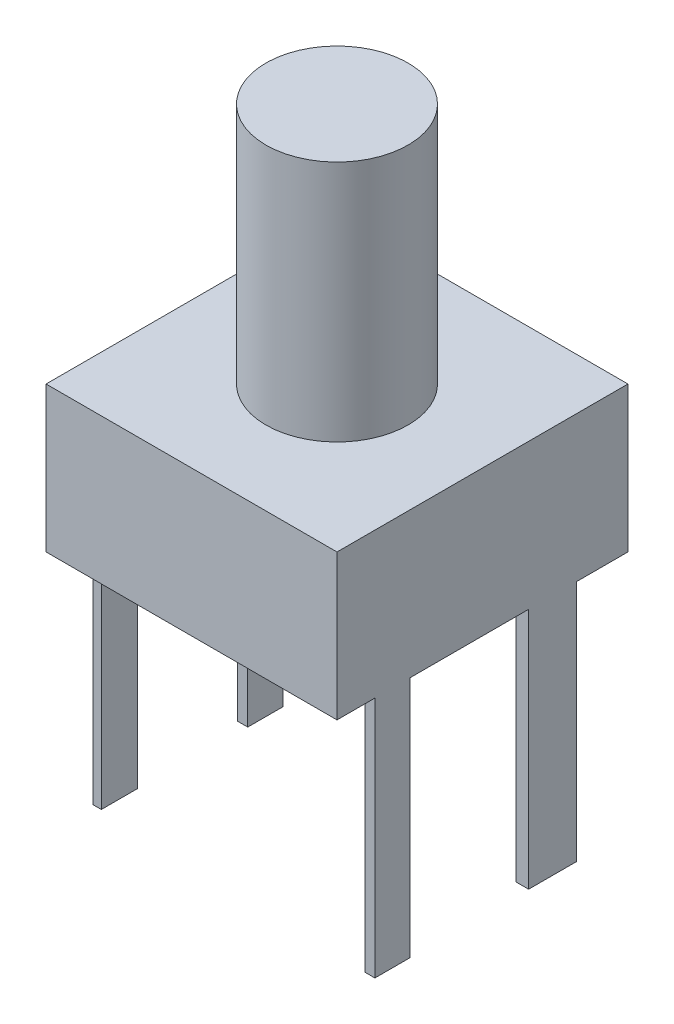
from build123d import *

# Parameters (mm, degrees)
SKETCH1_W           = 6
SKETCH1_H           = 6
BOSS_EXTRUDE1_DEPTH = 3
SKETCH2_R           = 1.46607231
BOSS_EXTRUDE2_DEPTH = 5
SKETCH3_W           = 0.169867938
SKETCH3_H           = 0.743920428
SKETCH3_W_2         = 0.207603032
SKETCH3_H_2         = 0.722357517
SKETCH3_W_3         = 0.261510309
SKETCH3_H_3         = 0.986503176
BOSS_EXTRUDE3_DEPTH = 5


with BuildPart() as part:
    # Sketch1 → Boss-Extrude1 (new body)
    with BuildSketch(Plane(origin=(0, 0, 0), x_dir=(1, 0, 0), z_dir=(0, 1, 0))):
        with Locations((3, -3)):
            Rectangle(SKETCH1_W, SKETCH1_H)
    extrude(amount=BOSS_EXTRUDE1_DEPTH)

    # Sketch2 → Boss-Extrude2 (add)
    with BuildSketch(Plane(origin=(0, 3, 0), x_dir=(1, 0, 0), z_dir=(0, 1, 0))):
        with Locations(Location((3, -3, 0), (0, 0, 270))):
            Circle(SKETCH2_R)
    extrude(amount=BOSS_EXTRUDE2_DEPTH)

    # Sketch3 → Boss-Extrude3 (add)
    with BuildSketch(Plane(origin=(0, 0, 0), x_dir=(-1, 0, 0), z_dir=(0, -1, 0))):
        with Locations((-0.084933969, -4.657648779)):
            Rectangle(SKETCH3_W, SKETCH3_H)
        with Locations((-0.103801516, -1.687357796)):
            Rectangle(SKETCH3_W_2, SKETCH3_H_2)
        with Locations((-5.896198484, -4.857105706)):
            Rectangle(SKETCH3_W_2, SKETCH3_H_2)
        with Locations((-5.869244846, -1.555284966)):
            Rectangle(SKETCH3_W_3, SKETCH3_H_3)
    extrude(amount=BOSS_EXTRUDE3_DEPTH)


solid = part.part
